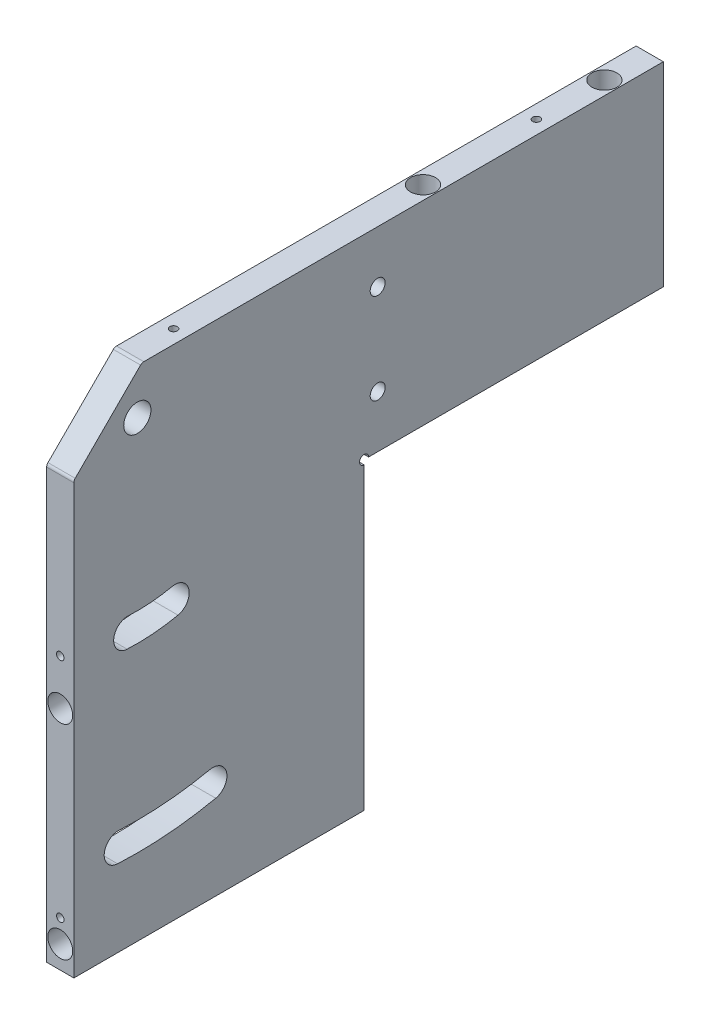
from build123d import *

# Parameters (mm, degrees)
SKETCH_1_W                = 260
SKETCH_1_H                = 220
EXTRUDE_1_DEPTH           = 6
SKETCH_4_W                = 132
SKETCH_4_H                = 134
CUT_EXTRUDE_1_DEPTH       = 171.716138663
HOLE_WIZARD_1_D           = 6.6
HOLE_WIZARD_1_CBORE_D     = 11
HOLE_WIZARD_1_CBORE_DEPTH = 6.8
HOLE_WIZARD_M12_1_D       = 12
CUT_EXTRUDE_2_DEPTH       = 171.716138663
HOLE_WIZARD_M6_1_D        = 5
HOLE_WIZARD_M6_1_DEPTH    = 15
HOLE_WIZARD_M6_1_TIP      = 1.502151548
HOLE_WIZARD_3_D           = 6.6
HOLE_WIZARD_3_CBORE_D     = 11
HOLE_WIZARD_3_CBORE_DEPTH = 87
HOLE_WIZARD_2_D           = 6.6
HOLE_WIZARD_2_CBORE_D     = 11
HOLE_WIZARD_2_CBORE_DEPTH = 48
HOLE_WIZARD_1_2_D         = 4
HOLE_WIZARD_M4_1_D        = 3.3
HOLE_WIZARD_M4_1_DEPTH    = 10.1
HOLE_WIZARD_M4_1_TIP      = 0.991420021
HOLE_WIZARD_M4_2_D        = 3.3
HOLE_WIZARD_M4_2_DEPTH    = 10.1
HOLE_WIZARD_M4_2_TIP      = 0.991420021
CHAMFER_1_SIZE            = 30
FILLET_1_R                = 2


with BuildPart() as part:
    # 草图1 → 凸台-拉伸1 (new, symmetric)
    with BuildSketch(Plane(origin=(0, 0, 0), x_dir=(0, 0, -1), z_dir=(1, 0, 0))):
        Rectangle(SKETCH_1_W, SKETCH_1_H)
    extrude(amount=EXTRUDE_1_DEPTH, both=True)

    # 草图4 → 切除-拉伸1 (cut, through all)
    with BuildSketch(Plane(origin=(6, 0, 0), x_dir=(0, 0, -1), z_dir=(1, 0, 0))):
        with Locations((64, -43)):
            Rectangle(SKETCH_4_W, SKETCH_4_H)
    extrude(amount=-CUT_EXTRUDE_1_DEPTH, mode=Mode.SUBTRACT)

    # Hole Wizard 1 (through all)
    with Locations(Plane(origin=(-6, -19.944864322, 4.622627096), x_dir=(0, 0, -1), z_dir=(-1, 0, 0))):
        with Locations((8.622627096, -106.944864322), (8.622627096, -66.944864322)):
            CounterBoreHole(HOLE_WIZARD_1_D / 2, HOLE_WIZARD_1_CBORE_D / 2, HOLE_WIZARD_1_CBORE_DEPTH)

    # M12 间隙孔1 (through all)
    with Locations(Plane.ZY.offset(6)):
        with Locations((102, 90)):
            Hole(HOLE_WIZARD_M12_1_D / 2)

    # 草图7 → 切除-拉伸2 (cut, through all)
    with BuildSketch(Plane.ZY.offset(6)):
        with BuildLine():
            ThreePointArc((86.666512802, 17.861614446), (96.21364169, 16.477346637), (105.859776773, 16.351071812))
            ThreePointArc((105.859776773, 16.351071812), (112.428311092, 10.436736946), (106.513976226, 3.868202627))
            ThreePointArc((106.513976226, 3.868202627), (95.232902993, 4.015879966), (84.067616667, 5.634769437))
            ThreePointArc((84.067616667, 5.634769437), (79.25364223, 13.047640009), (86.666512802, 17.861614446))
        make_face()
        with BuildLine():
            ThreePointArc((67.434681402, -72.617038622), (88.956175335, -75.737506733), (110.700852725, -76.022160153))
            ThreePointArc((110.700852725, -76.022160153), (116.615187591, -69.453625834), (110.046653272, -63.539290969))
            ThreePointArc((110.046653272, -63.539290969), (89.936914032, -63.276040061), (70.033577537, -60.390193613))
            ThreePointArc((70.033577537, -60.390193613), (62.620706965, -65.20416805), (67.434681402, -72.617038622))
        make_face()
    extrude(amount=-CUT_EXTRUDE_2_DEPTH, mode=Mode.SUBTRACT)

    # M6 螺纹孔1
    with Locations(Plane(origin=(0, 0, -130), x_dir=(-1, 0, 0), z_dir=(0, 0, -1))):
        with Locations((0, 87), (0, 47)):
            Hole(HOLE_WIZARD_M6_1_D / 2, depth=HOLE_WIZARD_M6_1_DEPTH)
            with Locations((0, 0, -(HOLE_WIZARD_M6_1_DEPTH + HOLE_WIZARD_M6_1_TIP / 2))):  # 118° drill point
                Cone(0, HOLE_WIZARD_M6_1_D / 2, HOLE_WIZARD_M6_1_TIP, mode=Mode.SUBTRACT)

    # 打孔尺寸根据内六角圆柱头螺钉的类型3 (through all)
    with Locations(Plane(origin=(4.643601276, 65.309968696, 130), x_dir=(-1, 0, 0), z_dir=(0, 0, 1))):
        with Locations((4.643601276, 75.309968696), (4.643601276, 165.309968696)):
            CounterBoreHole(HOLE_WIZARD_3_D / 2, HOLE_WIZARD_3_CBORE_D / 2, HOLE_WIZARD_3_CBORE_DEPTH)

    # 打孔尺寸根据内六角圆柱头螺钉的类型2 (through all)
    with Locations(Plane(origin=(-2.196087781, 110, 22.857251804), x_dir=(-1, 0, 0), z_dir=(0, 1, 0))):
        with Locations((-2.196087781, -52.857251804), (-2.196087781, -132.857251804)):
            CounterBoreHole(HOLE_WIZARD_2_D / 2, HOLE_WIZARD_2_CBORE_D / 2, HOLE_WIZARD_2_CBORE_DEPTH)

    # Hole Wizard 1 2 (through all)
    with Locations(Plane.ZY.offset(6)):
        with Locations((2, 24)):
            Hole(HOLE_WIZARD_1_2_D / 2)

    # M4 螺纹孔1
    with Locations(Plane.XY.offset(130)):
        with Locations((0, -90), (0, 10)):
            Hole(HOLE_WIZARD_M4_1_D / 2, depth=HOLE_WIZARD_M4_1_DEPTH)
            with Locations((0, 0, -(HOLE_WIZARD_M4_1_DEPTH + HOLE_WIZARD_M4_1_TIP / 2))):  # 118° drill point
                Cone(0, HOLE_WIZARD_M4_1_D / 2, HOLE_WIZARD_M4_1_TIP, mode=Mode.SUBTRACT)

    # M4 螺纹孔2
    with Locations(Plane(origin=(0, 110, 0), x_dir=(1, 0, 0), z_dir=(0, 1, 0))):
        with Locations((0, 80), (0, -80)):
            Hole(HOLE_WIZARD_M4_2_D / 2, depth=HOLE_WIZARD_M4_2_DEPTH)
            with Locations((0, 0, -(HOLE_WIZARD_M4_2_DEPTH + HOLE_WIZARD_M4_2_TIP / 2))):  # 118° drill point
                Cone(0, HOLE_WIZARD_M4_2_D / 2, HOLE_WIZARD_M4_2_TIP, mode=Mode.SUBTRACT)

    # 倒角1
    chamfer_1_edges = [part.edges().sort_by_distance(p)[0] for p in [
        (0, 110, 130),
    ]]
    chamfer(chamfer_1_edges, length=CHAMFER_1_SIZE)

    # 圆角1
    fillet_1_edges = [part.edges().sort_by_distance(p)[0] for p in [
        (0, 80, 130),
        (0, 110, 100),
    ]]
    fillet(fillet_1_edges, radius=FILLET_1_R)


solid = part.part
